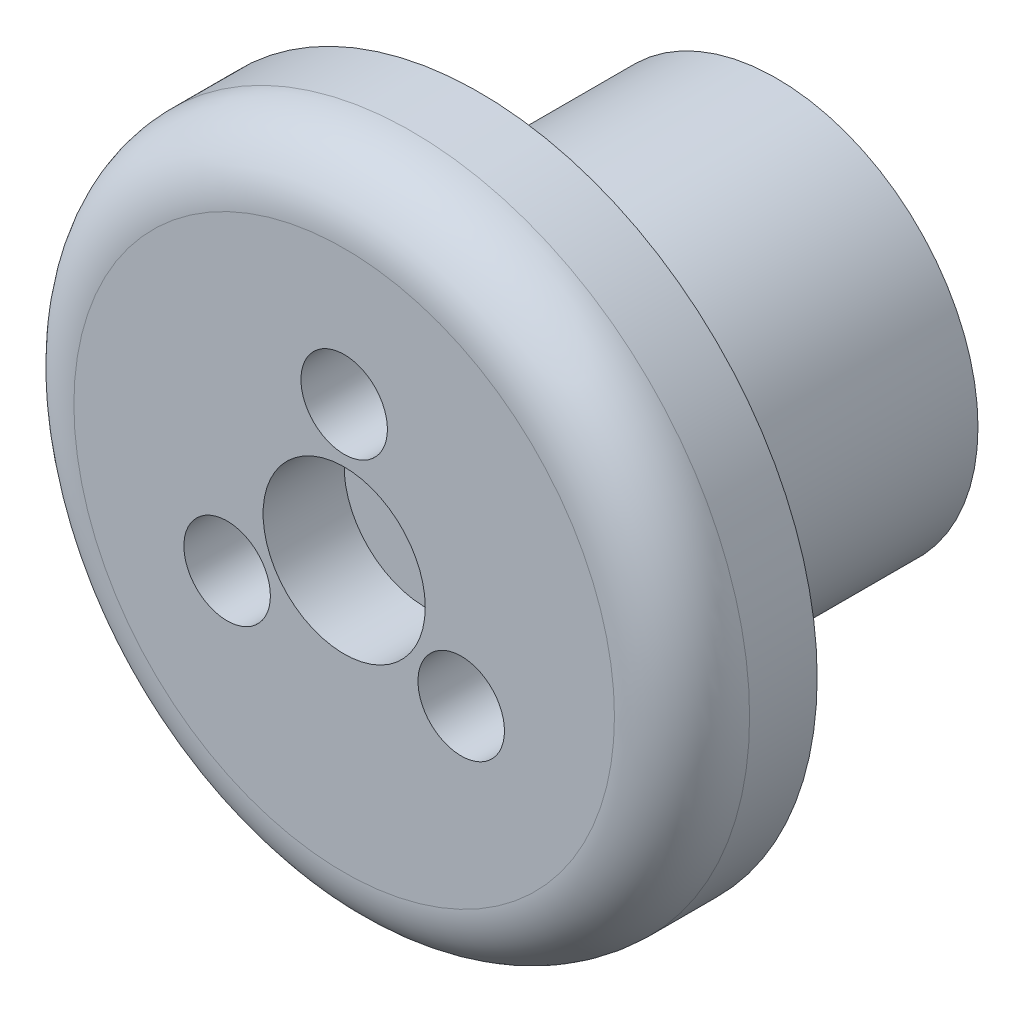
from build123d import *

# Parameters (mm, degrees)
SKETCH2_R           = 7.45
BOSS_EXTRUDE1_DEPTH = 11
SKETCH3_R           = 12.5
BOSS_EXTRUDE2_DEPTH = 5
SKETCH4_R           = 1.6
CUT_EXTRUDE1_DEPTH  = 24.843238035
FILLET2_R           = 2.5
SKETCH5_R           = 3
CUT_EXTRUDE2_DEPTH  = 3


with BuildPart() as part:
    # Sketch2 → Boss-Extrude1 (new body)
    with BuildSketch(Plane.XY):
        Circle(SKETCH2_R)
    extrude(amount=BOSS_EXTRUDE1_DEPTH)

    # Sketch3 → Boss-Extrude2 (add)
    with BuildSketch(Plane.XY.offset(11)):
        Circle(SKETCH3_R)
    extrude(amount=BOSS_EXTRUDE2_DEPTH)

    # Sketch4 → Cut-Extrude1 (cut, through all)
    with BuildSketch(Plane.XY.offset(16)):
        with Locations((0, 5)):
            Circle(SKETCH4_R)
        with Locations((4.330127019, -2.5)):
            Circle(SKETCH4_R)
        with Locations((-4.330127019, -2.5)):
            Circle(SKETCH4_R)
    extrude(amount=-CUT_EXTRUDE1_DEPTH, mode=Mode.SUBTRACT)

    # Fillet2
    fillet2_edges = [part.edges().sort_by_distance(p)[0] for p in [
        (-12.5, 0, 16),
    ]]
    fillet(fillet2_edges, radius=FILLET2_R)

    # Sketch5 → Cut-Extrude2 (cut)
    with BuildSketch(Plane.XY.offset(16)):
        Circle(SKETCH5_R)
    extrude(amount=-CUT_EXTRUDE2_DEPTH, mode=Mode.SUBTRACT)


solid = part.part
